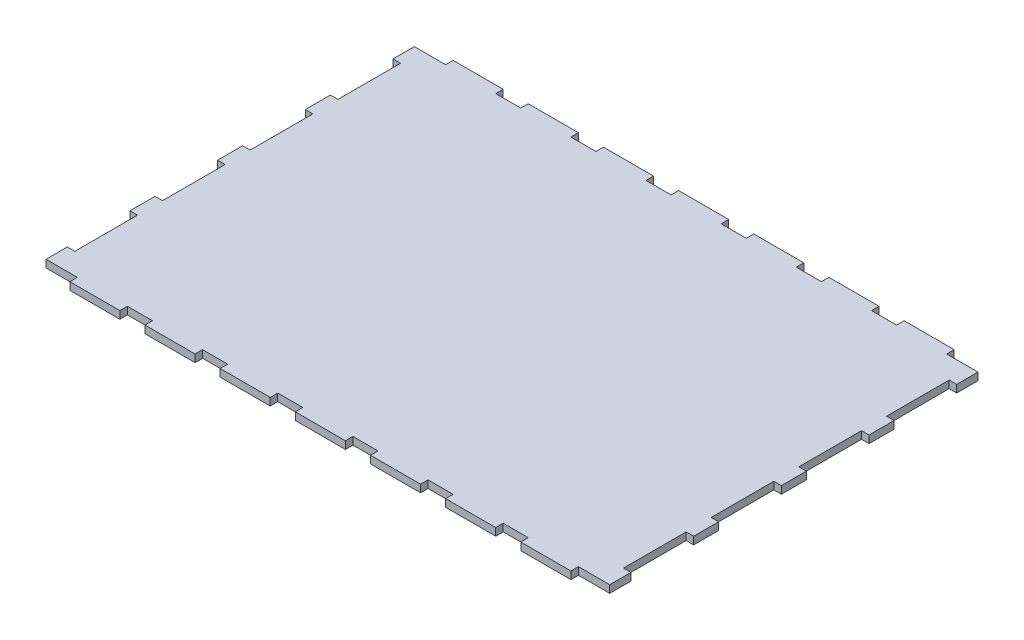
from build123d import *

# Parameters (mm, degrees)
BOSS_EXTRU_1_DEPTH = 6


with BuildPart() as part:
    # Esquisse1 → Boss.-Extru.1 (new body)
    with BuildSketch(Plane(origin=(0, 0, 0), x_dir=(1, 0, 0), z_dir=(0, 1, 0))):
        Polygon((0, 0), (25, 0), (25, -6), (65, -6), (65, 0), (85, 0), (85, -6), (125, -6), (125, 0), (145, 0), (145, -6), (185, -6), (185, 0), (205, 0), (205, -6), (245, -6), (245, 0), (265, 0), (265, -6), (305, -6), (305, 0), (325, 0), (325, -6), (365, -6), (365, 0), (385, 0), (385, -6), (425, -6), (425, 0), (450, 0), (450, 17), (444, 17), (444, 67), (450, 67), (450, 87), (444, 87), (444, 137), (450, 137), (450, 157), (444, 157), (444, 207), (450, 207), (450, 227), (444, 227), (444, 277), (450, 277), (450, 294), (425, 294), (425, 300), (385, 300), (385, 294), (365, 294), (365, 300), (325, 300), (325, 294), (305, 294), (305, 300), (265, 300), (265, 294), (245, 294), (245, 300), (205, 300), (205, 294), (185, 294), (185, 300), (145, 300), (145, 294), (125, 294), (125, 300), (85, 300), (85, 294), (65, 294), (65, 300), (25, 300), (25, 294), (0, 294), (0, 277), (6, 277), (6, 227), (0, 227), (0, 207), (6, 207), (6, 157), (0, 157), (0, 137), (6, 137), (6, 87), (0, 87), (0, 67), (6, 67), (6, 17), (0, 17), align=None)
    extrude(amount=BOSS_EXTRU_1_DEPTH)


solid = part.part
